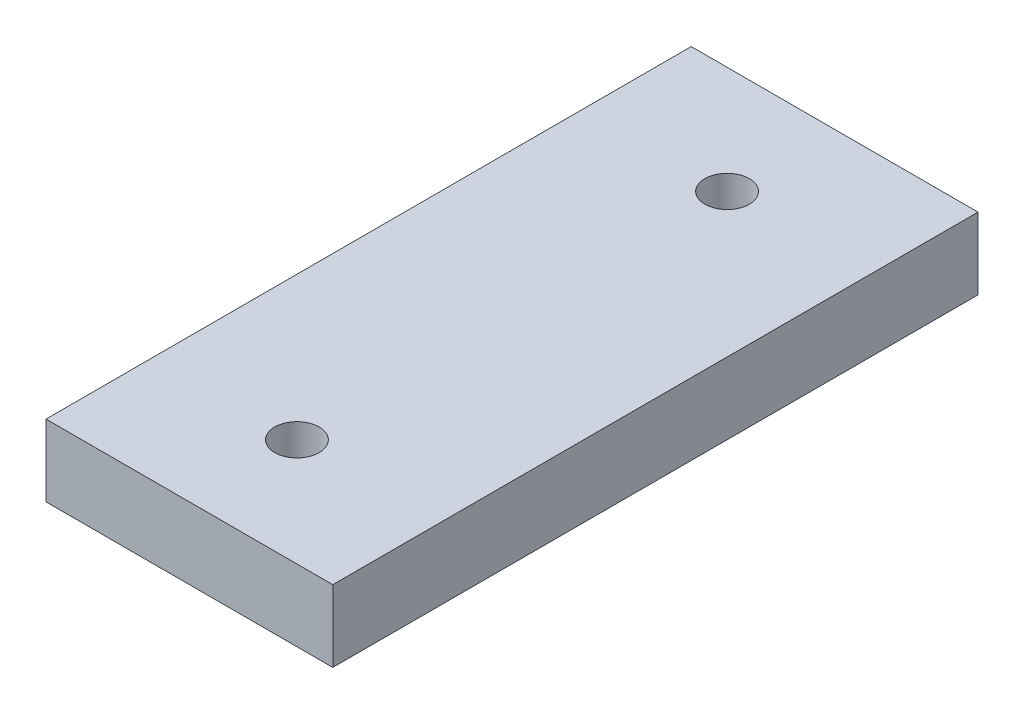
from build123d import *

# Parameters (mm, degrees)
SKETCH_1_W          = 20
SKETCH_1_H          = 45
EXTRUDE_1_DEPTH     = 5
SKETCH_2_R          = 1.55
CUT_EXTRUDE_1_DEPTH = 5


with BuildPart() as part:
    # 草图1 → 凸台-拉伸1 (new body)
    with BuildSketch(Plane(origin=(0, 0, 0), x_dir=(1, 0, 0), z_dir=(0, 1, 0))):
        Rectangle(SKETCH_1_W, SKETCH_1_H)
    extrude(amount=EXTRUDE_1_DEPTH)

    # 草图2 → 切除-拉伸1 (cut)
    with BuildSketch(Plane(origin=(0, 5, 0), x_dir=(1, 0, 0), z_dir=(0, 1, 0))):
        with Locations(Location((0, 15, 0), (0, 0, 270))):
            Circle(SKETCH_2_R)
        with Locations(Location((0, -15, 0), (0, 0, 90))):
            Circle(SKETCH_2_R)
    extrude(amount=-CUT_EXTRUDE_1_DEPTH, mode=Mode.SUBTRACT)


solid = part.part
